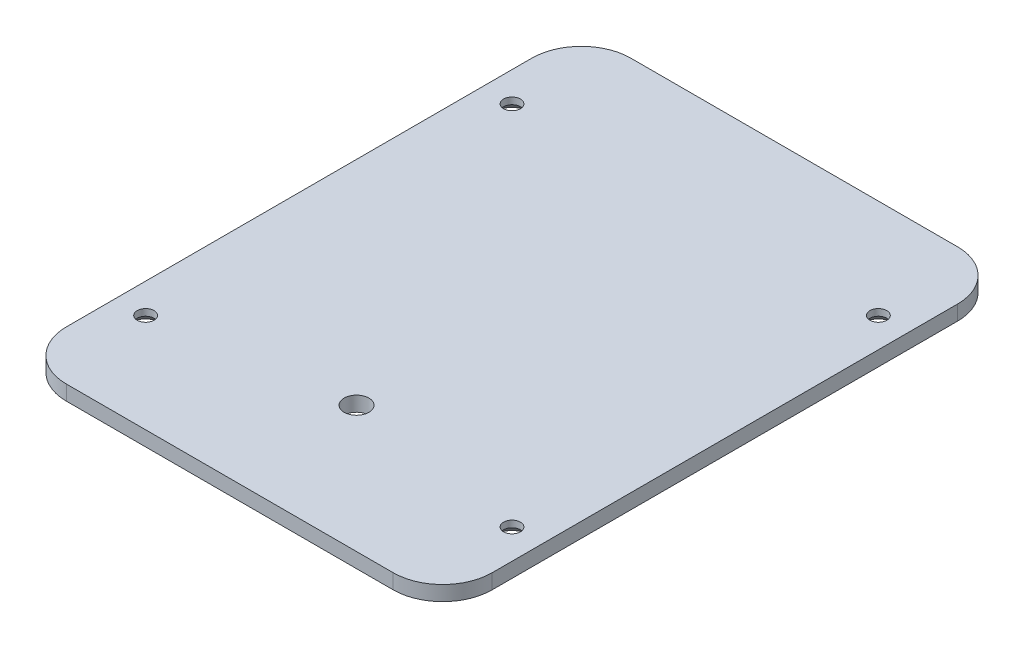
from build123d import *

# Parameters (mm, degrees)
BOSS_EXTRUDE1_DEPTH                                  = 3
SKETCH3_R                                            = 2.5
CUT_EXTRUDE1_DEPTH                                   = 3
CSK_FOR_M3_HEX_SOCKET_COUNTERSUNK_CAP_SC_D           = 3.4
CSK_FOR_M3_HEX_SOCKET_COUNTERSUNK_CAP_SC_DEPTH       = 20
CSK_FOR_M3_HEX_SOCKET_COUNTERSUNK_CAP_SC_CSINK_D     = 6.72
CSK_FOR_M3_HEX_SOCKET_COUNTERSUNK_CAP_SC_CSINK_ANGLE = 90
CSK_FOR_M3_HEX_SOCKET_COUNTERSUNK_CAP_SC_TIP         = 1.021463052


with BuildPart() as part:
    # Sketch1 → Boss-Extrude1 (new body)
    with BuildSketch(Plane(origin=(0, 0, 0), x_dir=(1, 0, 0), z_dir=(0, 1, 0))):
        with BuildLine():
            Line((33, -57), (-33, -57))
            ThreePointArc((-33, -57), (-40.071067812, -54.071067812), (-43, -47))
            Line((-43, -47), (-43, 47))
            ThreePointArc((-43, 47), (-40.071067812, 54.071067812), (-33, 57))
            Line((-33, 57), (33, 57))
            ThreePointArc((33, 57), (40.071067812, 54.071067812), (43, 47))
            Line((43, 47), (43, -47))
            ThreePointArc((43, -47), (40.071067812, -54.071067812), (33, -57))
        make_face()
    extrude(amount=BOSS_EXTRUDE1_DEPTH)

    # Sketch3 → Cut-Extrude1 (cut)
    with BuildSketch(Plane.XZ):
        with Locations(Location((0, 31.4, 0), (0, 0, 270))):
            Circle(SKETCH3_R)
    extrude(amount=-CUT_EXTRUDE1_DEPTH, mode=Mode.SUBTRACT)

    # CSK for M3 Hex Socket Countersunk Cap Screw1
    with Locations(Plane(origin=(0, 0, 0), x_dir=(-1, 0, 0), z_dir=(0, -1, 0))):
        with Locations((37, 37), (37, -37), (-37, 37), (-37, -37)):
            CounterSinkHole(CSK_FOR_M3_HEX_SOCKET_COUNTERSUNK_CAP_SC_D / 2, CSK_FOR_M3_HEX_SOCKET_COUNTERSUNK_CAP_SC_CSINK_D / 2, depth=CSK_FOR_M3_HEX_SOCKET_COUNTERSUNK_CAP_SC_DEPTH, counter_sink_angle=CSK_FOR_M3_HEX_SOCKET_COUNTERSUNK_CAP_SC_CSINK_ANGLE)
            with Locations((0, 0, -(CSK_FOR_M3_HEX_SOCKET_COUNTERSUNK_CAP_SC_DEPTH + CSK_FOR_M3_HEX_SOCKET_COUNTERSUNK_CAP_SC_TIP / 2))):  # 118° drill point
                Cone(0, CSK_FOR_M3_HEX_SOCKET_COUNTERSUNK_CAP_SC_D / 2, CSK_FOR_M3_HEX_SOCKET_COUNTERSUNK_CAP_SC_TIP, mode=Mode.SUBTRACT)


solid = part.part
